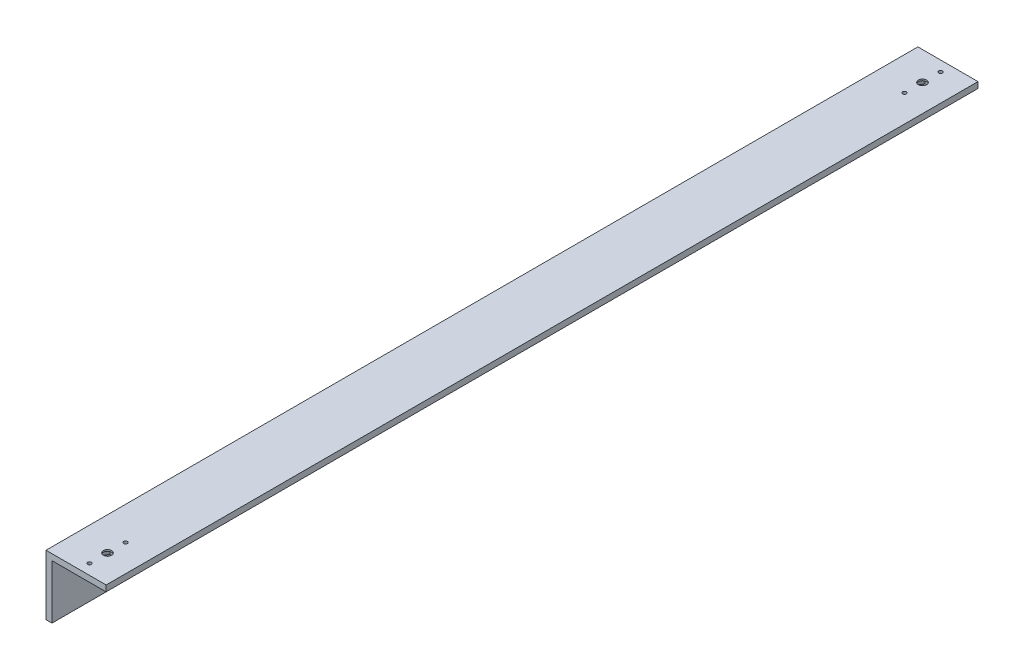
from build123d import *

# Parameters (mm, degrees)
BOSS_EXTRUDE1_DEPTH     = 580
CUT_EXTRUDE1_DEPTH      = 3
TAP_DRILL_FOR_M3_TAP1_D = 2.5
M5_CLEARANCE_HOLE1_D    = 5.5


with BuildPart() as part:
    # Sketch1 → Boss-Extrude1 (new body)
    with BuildSketch(Plane.XY):
        Polygon((0, 0), (0, 40), (40, 40), (40, 36), (4, 36), (4, 0), align=None)
    extrude(amount=BOSS_EXTRUDE1_DEPTH)

    # Sketch2 → Cut-Extrude1 (cut)
    with BuildSketch(Plane(origin=(0, 36, 0), x_dir=(1, 0, 0), z_dir=(0, 1, 0))):
        Polygon((24.309401077, -14.924264069), (19.690598923, -14.924264069), (17.381197846, -18.924264069), (19.690598923, -22.924264069), (24.309401077, -22.924264069), (26.618802154, -18.924264069), align=None)
        Polygon((24.309401077, -557.075735931), (19.690598923, -557.075735931), (17.381197846, -561.075735931), (19.690598923, -565.075735931), (24.309401077, -565.075735931), (26.618802154, -561.075735931), align=None)
    extrude(amount=CUT_EXTRUDE1_DEPTH, mode=Mode.SUBTRACT)

    # Tap Drill for M3 Tap1 (through all)
    with Locations(Plane(origin=(0, 40, 0), x_dir=(1, 0, 0), z_dir=(0, 1, 0))):
        with Locations((22, -549.075735931), (22, -573.075735931), (22, -30.924264069), (22, -6.924264069)):
            Hole(TAP_DRILL_FOR_M3_TAP1_D / 2)

    # M5 Clearance Hole1 (through all)
    with Locations(Plane(origin=(0, 39, 0), x_dir=(-1, 0, 0), z_dir=(0, -1, 0))):
        with Locations((-22, -561.075735931), (-22, -18.924264069)):
            Hole(M5_CLEARANCE_HOLE1_D / 2)


solid = part.part
